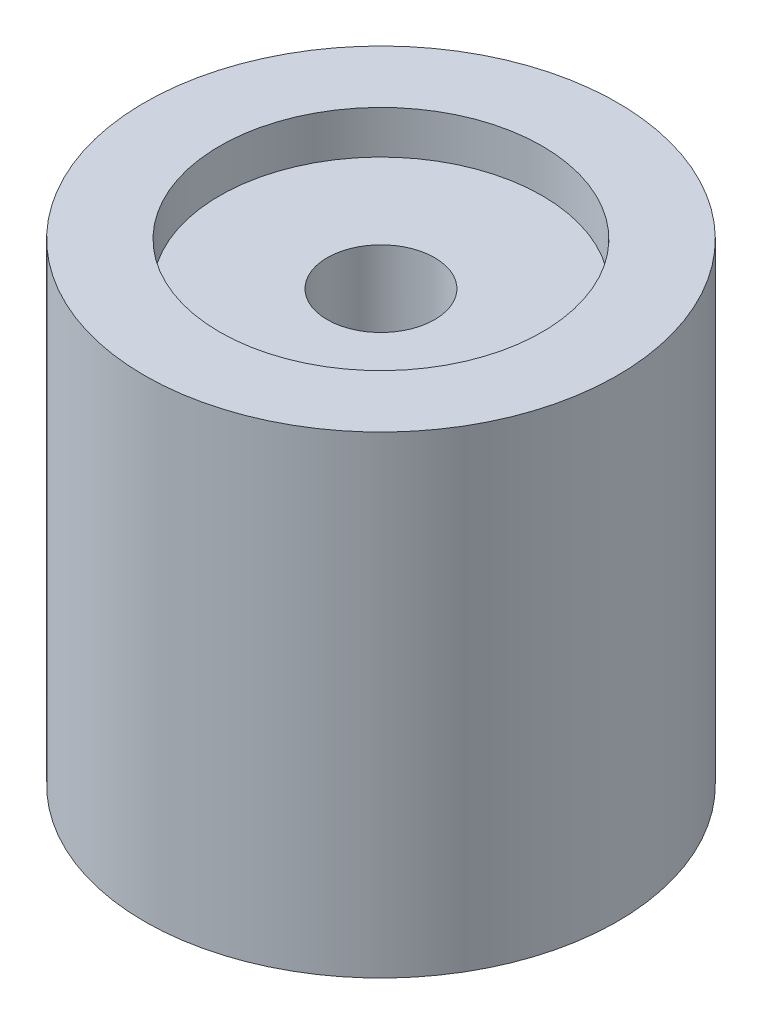
from build123d import *

# Parameters (mm, degrees)
SKETCH1_R           = 22
SKETCH1_R_2         = 5
BOSS_EXTRUDE1_DEPTH = 44
SKETCH2_R           = 15
CUT_EXTRUDE1_DEPTH  = 4
CUT_EXTRUDE2_START  = -4
SKETCH3_R           = 15
CUT_EXTRUDE2_DEPTH  = 4


with BuildPart() as part:
    # Sketch1 → Boss-Extrude1 (new body)
    with BuildSketch(Plane(origin=(0, 0, 0), x_dir=(1, 0, 0), z_dir=(0, 1, 0))):
        with Locations(Location((0, 0, 0), (0, 0, 270))):
            Circle(SKETCH1_R)
        with Locations(Location((0, 0, 0), (0, 0, 270))):
            Circle(SKETCH1_R_2, mode=Mode.SUBTRACT)
    extrude(amount=BOSS_EXTRUDE1_DEPTH)

    # Sketch2 → Cut-Extrude1 (cut)
    with BuildSketch(Plane(origin=(0, 44, 0), x_dir=(1, 0, 0), z_dir=(0, 1, 0))):
        with Locations(Location((0, 0, 0), (0, 0, 270))):
            Circle(SKETCH2_R)
    extrude(amount=-CUT_EXTRUDE1_DEPTH, mode=Mode.SUBTRACT)

    # Sketch3 → Cut-Extrude2 (cut)
    with BuildSketch(Plane.XZ.offset(CUT_EXTRUDE2_START)):
        with Locations(Location((0, 0, 0), (0, 0, 90))):
            Circle(SKETCH3_R)
    extrude(amount=CUT_EXTRUDE2_DEPTH, mode=Mode.SUBTRACT)


solid = part.part
